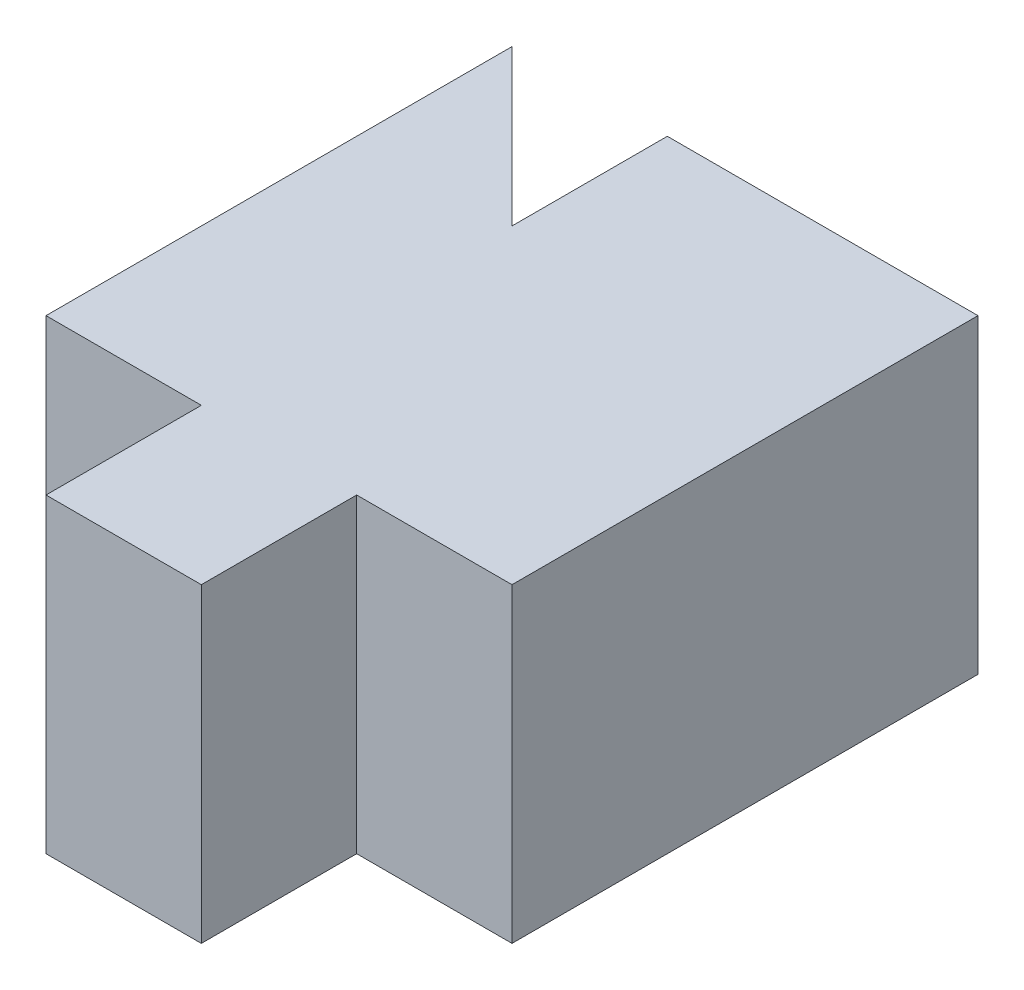
from build123d import *

# Parameters (mm, degrees)
BOSS_EXTRUDE1_DEPTH = 10


with BuildPart() as part:
    # Sketch5 → Boss-Extrude1 (new body)
    with BuildSketch(Plane(origin=(0, 0, 0), x_dir=(1, 0, 0), z_dir=(0, 1, 0))):
        Polygon((-7.5, 7.5), (-2.5, 2.5), (-2.5, 7.5), (7.5, 7.5), (7.5, -7.5), (2.5, -7.5), (2.5, -12.5), (-2.5, -12.5), (-2.5, -7.5), (-7.5, -7.5), align=None)
    extrude(amount=BOSS_EXTRUDE1_DEPTH)


solid = part.part
